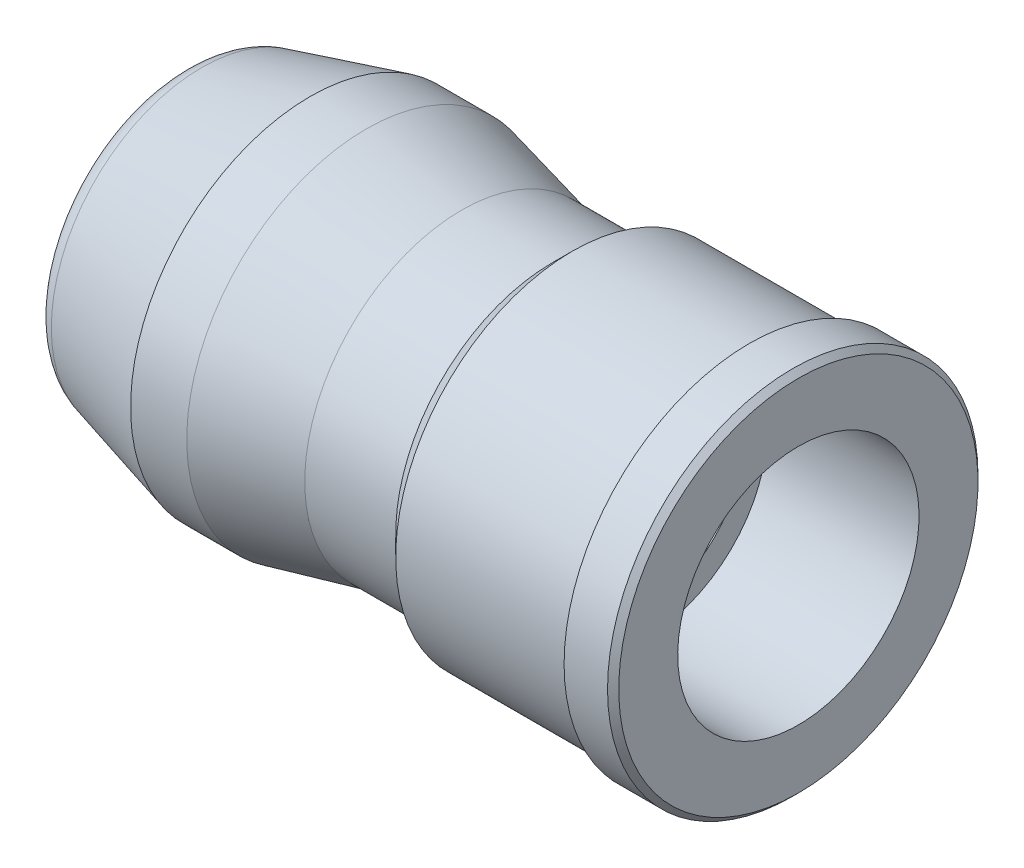
from build123d import *

# Parameters (mm, degrees)
SKETCH3_R          = 1.706794341
CUT_EXTRUDE1_DEPTH = 10
SKETCH4_R          = 2.050203782
CUT_EXTRUDE2_DEPTH = 0.5
FILLET1_R          = 0.5
CHAMFER1_SIZE      = 0.1


with BuildPart() as part:
    # Sketch1 → Revolve1 (revolve)
    with BuildSketch(Plane.XY):
        Polygon((0, 0), (0, 2.58), (2.3, 3.196283143), (3.3, 3.196283143), (5, 2.793868124), (6.62, 2.793868124), (6.976131876, 3.15), (10.126131876, 3.15), (10.126131876, 3.3), (11, 3.3), (11, 2.15), (8.3, 2.15), (8.3, 0), align=None)
    revolve(axis=Axis((8.3, 0, 0), (-1, 0, 0)))

    # Sketch3 → Cut-Extrude1 (cut)
    with BuildSketch(Plane.ZY):
        with Locations(Location((0, 0, 0), (0, 0, 270))):
            Circle(SKETCH3_R)
    extrude(amount=-CUT_EXTRUDE1_DEPTH, mode=Mode.SUBTRACT)

    # Sketch4 → Cut-Extrude2 (cut)
    with BuildSketch(Plane.ZY):
        with Locations(Location((0, 0, 0), (0, 0, 270))):
            Circle(SKETCH4_R)
    extrude(amount=-CUT_EXTRUDE2_DEPTH, mode=Mode.SUBTRACT)

    # Fillet1
    fillet1_edges = [part.edges().sort_by_distance(p)[0] for p in [
        (0, -2.58, 0),
    ]]
    fillet(fillet1_edges, radius=FILLET1_R)

    # Chamfer1
    chamfer1_edges = [part.edges().sort_by_distance(p)[0] for p in [
        (11, -3.3, 0),
        (10.126131876, -3.15, 0),
    ]]
    chamfer(chamfer1_edges, length=CHAMFER1_SIZE)


solid = part.part
